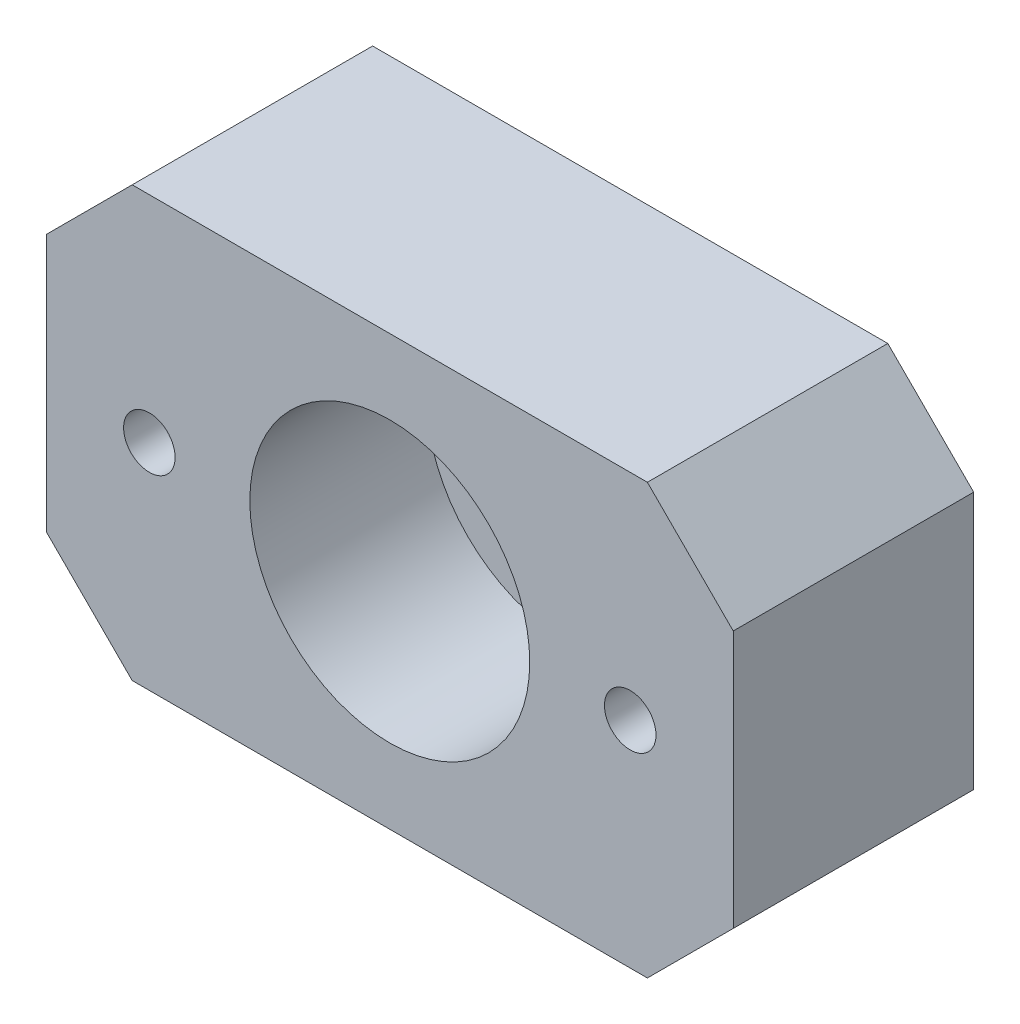
from build123d import *

# Parameters (mm, degrees)
SKETCH1_W           = 40
SKETCH1_H           = 25
BOSS_EXTRUDE1_DEPTH = 14
SKETCH2_R           = 8.15
CUT_EXTRUDE1_DEPTH  = 10.3
CUT_EXTRUDE2_REACH  = 50.281
SKETCH3_R           = 2.65
CUT_EXTRUDE3_REACH  = 51.204
SKETCH4_R           = 1.5
CHAMFER1_SIZE       = 5


with BuildPart() as part:
    # Sketch1 → Boss-Extrude1 (new body)
    with BuildSketch(Plane.XY):
        with Locations((20, 12.5)):
            Rectangle(SKETCH1_W, SKETCH1_H)
    extrude(amount=BOSS_EXTRUDE1_DEPTH)

    # Sketch2 → Cut-Extrude1 (cut)
    with BuildSketch(Plane.XY.offset(14)):
        with Locations((20, 12.5)):
            Circle(SKETCH2_R)
    extrude(amount=-CUT_EXTRUDE1_DEPTH, mode=Mode.SUBTRACT)

    # Sketch3 → Cut-Extrude2 (cut, up to next)
    with BuildSketch(Plane.XY.offset(3.7), mode=Mode.PRIVATE) as cut_extrude2_sk1:
        with Locations((20, 12.5)):
            Circle(SKETCH3_R)
    cut_extrude2_tool1 = extrude(cut_extrude2_sk1.sketch, amount=-CUT_EXTRUDE2_REACH, mode=Mode.PRIVATE) & part.part
    add(cut_extrude2_tool1.solids().sort_by_distance((20, 12.5, 3.7))[0], mode=Mode.SUBTRACT)

    # Sketch4 → Cut-Extrude3 (cut, up to next)
    with BuildSketch(Plane.XY.offset(14), mode=Mode.PRIVATE) as cut_extrude3_sk1:
        with Locations((6, 12.5)):
            Circle(SKETCH4_R)
    cut_extrude3_tool1 = extrude(cut_extrude3_sk1.sketch, amount=-CUT_EXTRUDE3_REACH, mode=Mode.PRIVATE) & part.part
    # Sketch4 → Cut-Extrude3 (cut, up to next)
    with BuildSketch(Plane.XY.offset(14), mode=Mode.PRIVATE) as cut_extrude3_sk2:
        with Locations((34, 12.5)):
            Circle(SKETCH4_R)
    cut_extrude3_tool2 = extrude(cut_extrude3_sk2.sketch, amount=-CUT_EXTRUDE3_REACH, mode=Mode.PRIVATE) & part.part
    add(cut_extrude3_tool1.solids().sort_by_distance((6, 12.5, 14))[0], mode=Mode.SUBTRACT)
    add(cut_extrude3_tool2.solids().sort_by_distance((34, 12.5, 14))[0], mode=Mode.SUBTRACT)

    # Chamfer1
    chamfer1_edges = [part.edges().sort_by_distance(p)[0] for p in [
        (0, 25, 7),
        (40, 25, 7),
        (40, 0, 7),
        (0, 0, 7),
    ]]
    chamfer(chamfer1_edges, length=CHAMFER1_SIZE)


solid = part.part
